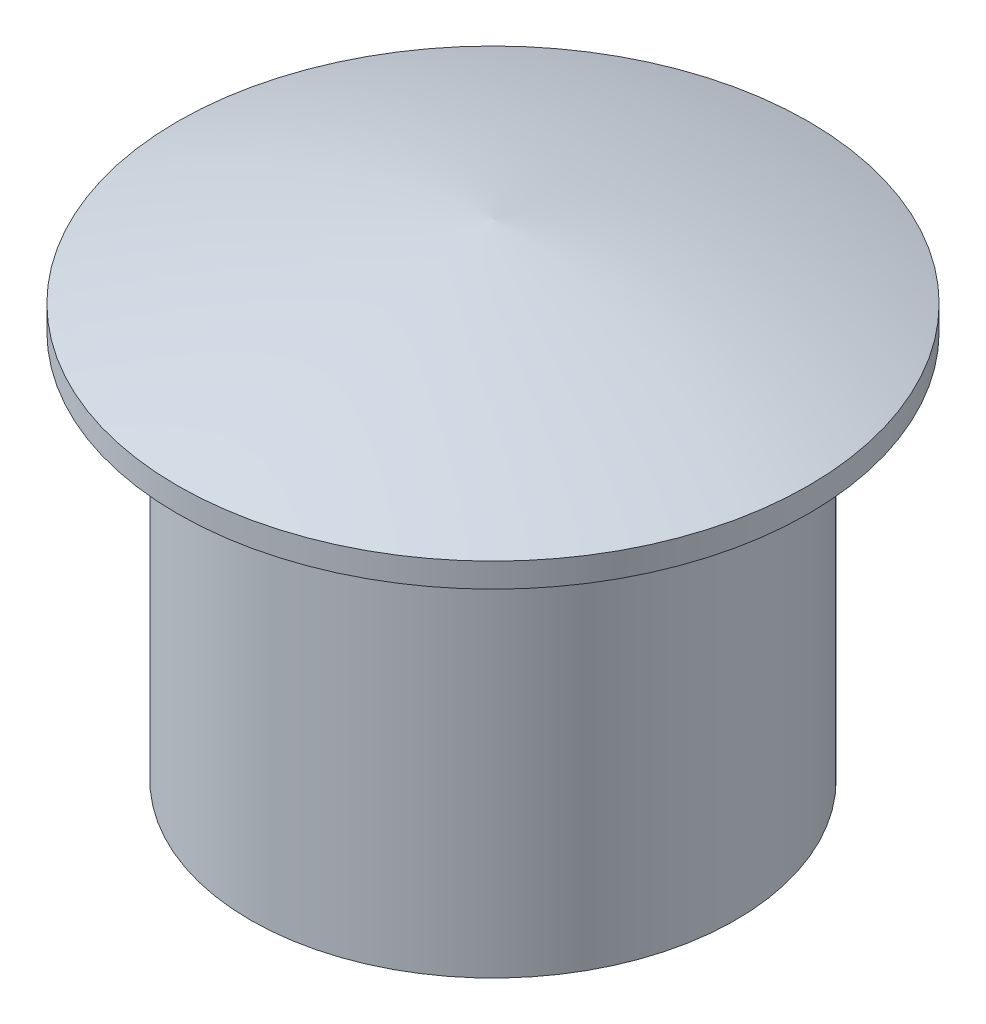
from build123d import *


with BuildPart() as part:
    # Sketch1 → Revolve1 (revolve)
    with BuildSketch(Plane.XY, mode=Mode.PRIVATE) as revolve1_sk:
        with BuildLine():
            Line((-10, -4), (-10, -20))
            Line((-10, -20), (0, -20))
            Line((0, -20), (0, 0))
            ThreePointArc((0, 0), (-6.588528815, -1.116375135), (-13, -3))
            Line((-13, -3), (-13, -4))
            Line((-13, -4), (-10, -4))
        make_face()
    revolve(revolve1_sk.sketch.rotate(Axis((0, 20.132450331, 0), (0, -1, 0)), 270), axis=Axis((0, 20.132450331, 0), (0, -1, 0)))


solid = part.part
